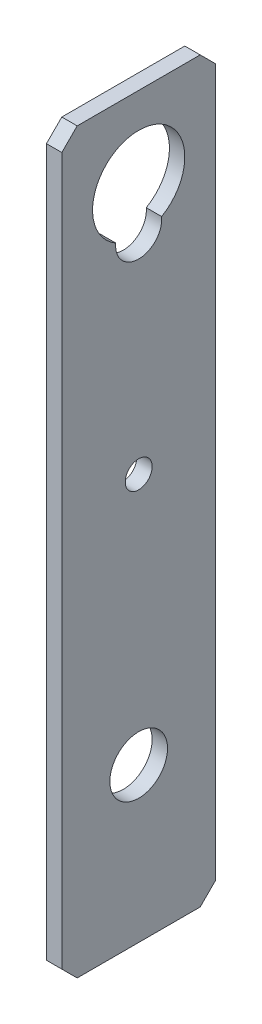
from build123d import *

# Parameters (mm, degrees)
SKETCH1_W           = 20
SKETCH1_H           = 96
BOSS_EXTRUDE2_DEPTH = 2
SKETCH3_R           = 1.75
SKETCH3_R_2         = 3.75
CUT_EXTRUDE1_DEPTH  = 50.071376586
CHAMFER1_SIZE       = 2


with BuildPart() as part:
    # Sketch1 → Boss-Extrude2 (new body)
    with BuildSketch(Plane(origin=(0, 0, 0), x_dir=(0, 0, -1), z_dir=(1, 0, 0))):
        Rectangle(SKETCH1_W, SKETCH1_H)
    extrude(amount=BOSS_EXTRUDE2_DEPTH)

    # Sketch3 → Cut-Extrude1 (cut, through all)
    with BuildSketch(Plane(origin=(2, 0, 0), x_dir=(0, 0, -1), z_dir=(1, 0, 0))):
        with Locations((0, 4.75)):
            Circle(SKETCH3_R)
        with Locations((0, -28)):
            Circle(SKETCH3_R_2)
        with BuildLine():
            ThreePointArc((2.985415651, 32.295454545), (0, 43.5), (-2.985415651, 32.295454545))
            ThreePointArc((-2.985415651, 32.295454545), (0, 29), (2.985415651, 32.295454545))
        make_face()
    extrude(amount=-CUT_EXTRUDE1_DEPTH, mode=Mode.SUBTRACT)

    # Chamfer1
    chamfer1_edges = [part.edges().sort_by_distance(p)[0] for p in [
        (1, -48, -10),
        (1, -48, 10),
        (1, 48, 10),
        (1, 48, -10),
    ]]
    chamfer(chamfer1_edges, length=CHAMFER1_SIZE)


solid = part.part
